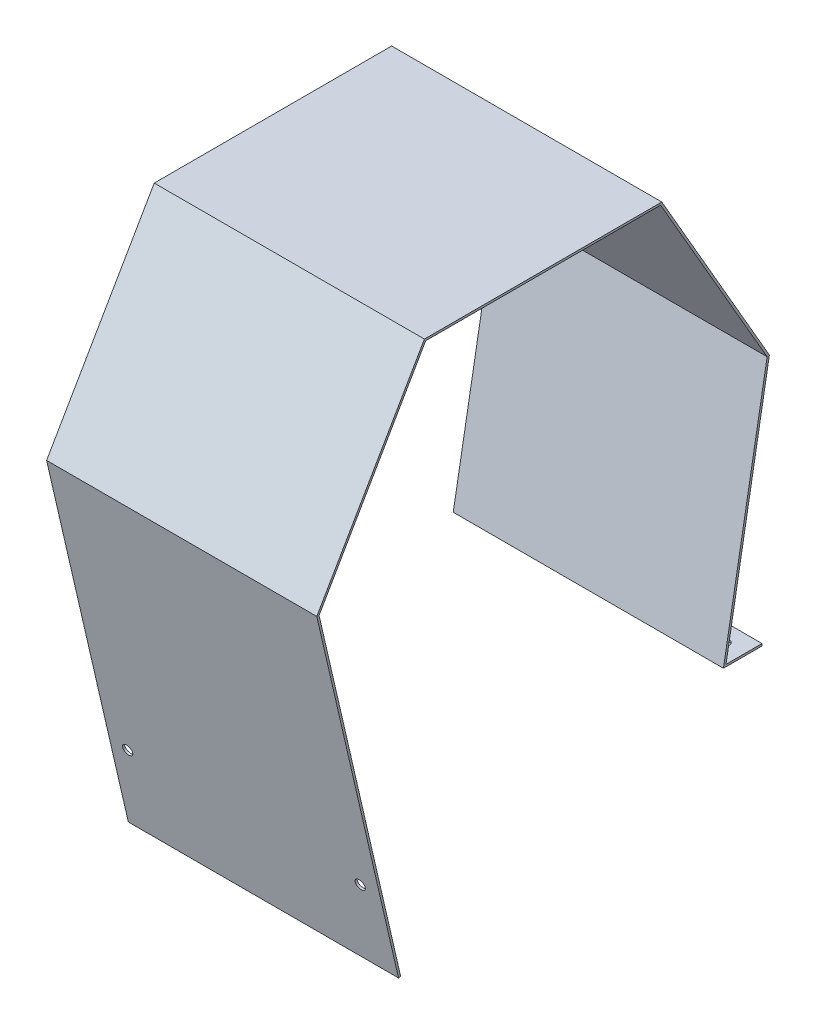
from build123d import *

# Parameters (mm, degrees)
BOSS_EXTRUDE1_DEPTH      = 97
BOSS_EXTRUDE1_DEPTH_BACK = 64
SKETCH6_R                = 3
CUT_EXTRUDE1_DEPTH       = 10
SKETCH8_R                = 3
CUT_EXTRUDE3_DEPTH       = 10


with BuildPart() as part:
    # Sketch3 → Boss-Extrude1 (new, two sides: drawn at the far end of the back side and taken through both)
    with BuildSketch(Plane(origin=(-16.16759993, 0, 0), x_dir=(0, 0, -1), z_dir=(1, 0, 0)).offset(-BOSS_EXTRUDE1_DEPTH_BACK)):
        Polygon((746.208968128, 603.456840762), (886.208968128, 603.456840762), (949.708968128, 493.471614481), (923.661741478, 345.75045153), (946.661741478, 345.75045153), (946.661741478, 347.02045153), (925.175268541, 347.02045153), (951.03994149, 493.706300996), (886.94220297, 604.726840762), (745.475733286, 604.726840762), (681.358982713, 493.673371154), (730.060945884, 282.721992649), (731.298395866, 283.007680488), (682.708968128, 493.471614481), align=None)
    extrude(amount=BOSS_EXTRUDE1_DEPTH + BOSS_EXTRUDE1_DEPTH_BACK)

    # Sketch6 → Cut-Extrude1 (cut)
    with BuildSketch(Plane(origin=(0, 347.02045153, 0), x_dir=(1, 0, 0), z_dir=(0, 1, 0))):
        with Locations(Location((-69.5, 935.918505009, 0), (0, 0, 180))):
            Circle(SKETCH6_R)
        with Locations(Location((69.000000001, 935.918505009, 0), (0, 0, 180))):
            Circle(SKETCH6_R)
    extrude(amount=-CUT_EXTRUDE1_DEPTH, mode=Mode.SUBTRACT)

    # Sketch8 → Cut-Extrude3 (cut)
    with BuildSketch(Plane(origin=(0, 174.325401486, -755.08627081), x_dir=(1, 0, 0), z_dir=(0, -0.22495105434386187, 0.9743700647852359))):
        with Locations(Location((69, 160.202749263, 0), (0, 0, 270))):
            Circle(SKETCH8_R)
        with Locations(Location((-69.5, 160.49556469, 0), (0, 0, 270))):
            Circle(SKETCH8_R)
    extrude(amount=-CUT_EXTRUDE3_DEPTH, mode=Mode.SUBTRACT)


solid = part.part
